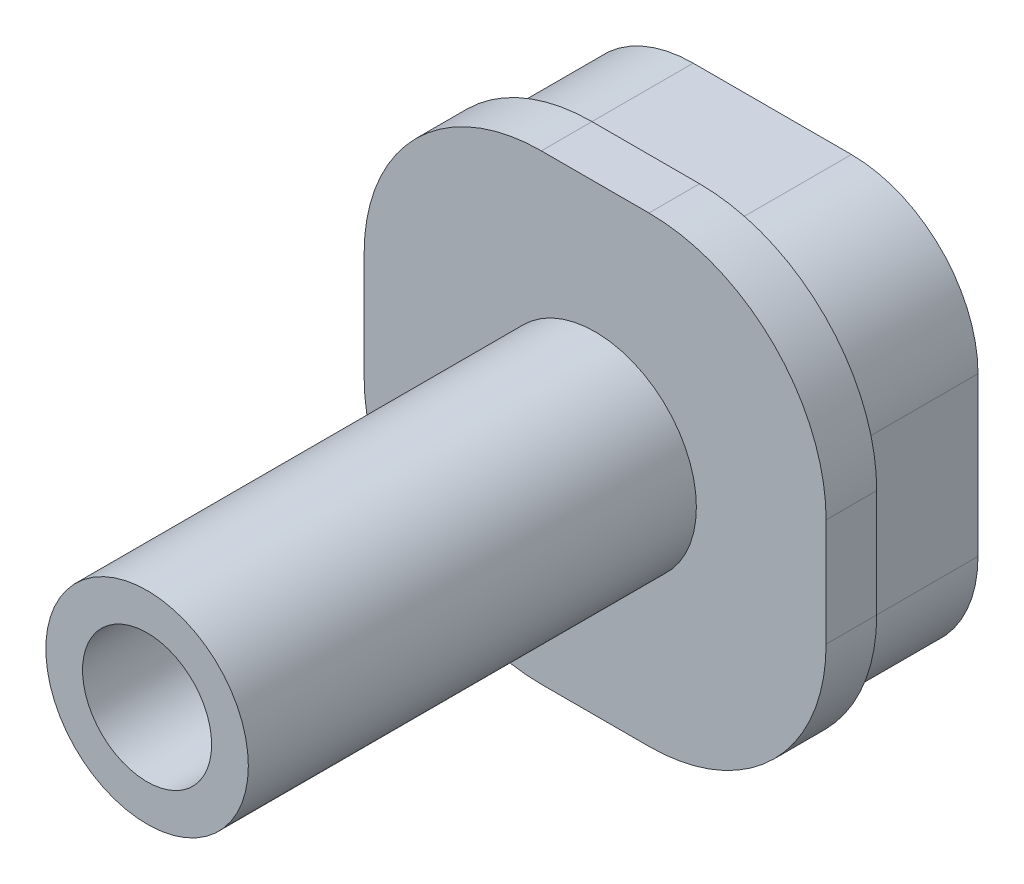
from build123d import *

# Parameters (mm, degrees)
SKETCH1_W           = 16.25
SKETCH1_H           = 16.25
SKETCH1_W_2         = 12.25
SKETCH1_H_2         = 12.25
BOSS_EXTRUDE1_DEPTH = 5
FILLET1_R           = 5
SKETCH2_W           = 18.25
SKETCH2_H           = 18.25
BOSS_EXTRUDE2_DEPTH = 2
FILLET2_R           = 7
SKETCH4_R           = 4
BOSS_EXTRUDE3_DEPTH = 17.7
SKETCH6_R           = 2.55
CUT_EXTRUDE1_DEPTH  = 16.7


with BuildPart() as part:
    # Sketch1 → Boss-Extrude1 (new body)
    with BuildSketch(Plane.XY):
        Rectangle(SKETCH1_W, SKETCH1_H)
        Rectangle(SKETCH1_W_2, SKETCH1_H_2, mode=Mode.SUBTRACT)
    extrude(amount=BOSS_EXTRUDE1_DEPTH)

    # Fillet1
    fillet1_edges = [part.edges().sort_by_distance(p)[0] for p in [
        (6.125, -6.125, 2.5),
        (6.125, 6.125, 2.5),
        (-6.125, 6.125, 2.5),
        (-6.125, -6.125, 2.5),
        (-8.125, 8.125, 2.5),
        (8.125, 8.125, 2.5),
        (8.125, -8.125, 2.5),
        (-8.125, -8.125, 2.5),
    ]]
    fillet(fillet1_edges, radius=FILLET1_R)

    # Sketch2 → Boss-Extrude2 (add)
    with BuildSketch(Plane.XY.offset(5)):
        Rectangle(SKETCH2_W, SKETCH2_H)
    extrude(amount=BOSS_EXTRUDE2_DEPTH)

    # Fillet2
    fillet2_edges = [part.edges().sort_by_distance(p)[0] for p in [
        (-9.125, 9.125, 6),
        (-9.125, -9.125, 6),
        (9.125, -9.125, 6),
        (9.125, 9.125, 6),
    ]]
    fillet(fillet2_edges, radius=FILLET2_R)

    # Sketch4 → Boss-Extrude3 (add)
    with BuildSketch(Plane.XY.offset(7)):
        Circle(SKETCH4_R)
    extrude(amount=BOSS_EXTRUDE3_DEPTH)

    # Sketch6 → Cut-Extrude1 (cut)
    with BuildSketch(Plane.XY.offset(24.7)):
        Circle(SKETCH6_R)
    extrude(amount=-CUT_EXTRUDE1_DEPTH, mode=Mode.SUBTRACT)


solid = part.part
